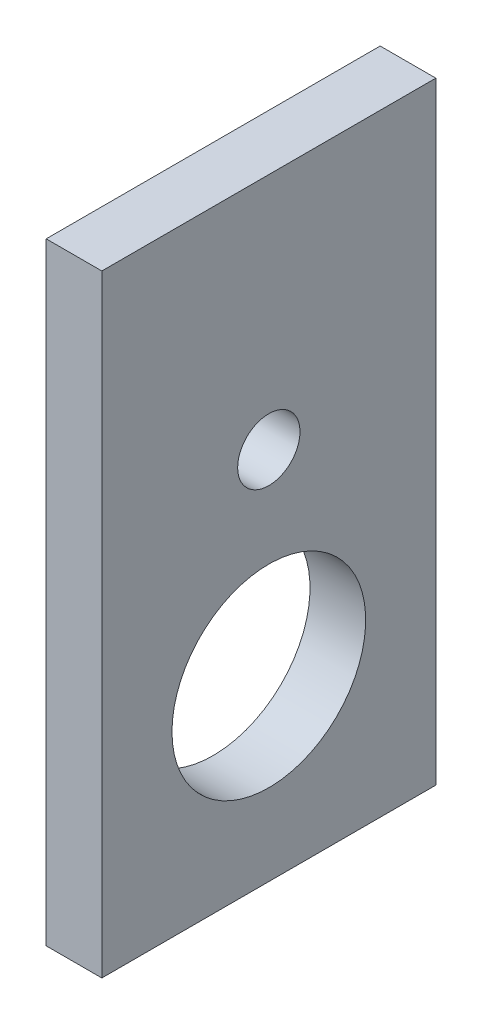
from build123d import *

# Parameters (mm, degrees)
BOSS_EXTRUDE1_DEPTH = 38.1
SKETCH2_R           = 11.049
CUT_EXTRUDE1_DEPTH  = 6.35
SKETCH2_4_R         = 3.556
CUT_EXTRUDE2_DEPTH  = 6.35
SKETCH4_W           = 94.447991824
SKETCH4_H           = 31.75
CUT_EXTRUDE5_DEPTH  = 76.2


with BuildPart() as part:
    # Sketch1 → Boss-Extrude1 (new body)
    with BuildSketch(Plane.XY):
        Polygon((0, 76.2), (0, 0), (6.35, 0), (6.35, 69.85), (94.447991824, 69.85), (94.447991824, 101.6), (88.097991824, 101.6), (88.097991824, 76.2), align=None)
    extrude(amount=BOSS_EXTRUDE1_DEPTH)

    # Sketch2 → Cut-Extrude1 (cut)
    with BuildSketch(Plane.ZY):
        with Locations((19.05, 20.32)):
            Circle(SKETCH2_R)
    extrude(amount=-CUT_EXTRUDE1_DEPTH, mode=Mode.SUBTRACT)

    # Sketch2<4> → Cut-Extrude2 (cut)
    with BuildSketch(Plane.ZY):
        with Locations((19.05, 42.672)):
            Circle(SKETCH2_4_R)
    extrude(amount=-CUT_EXTRUDE2_DEPTH, mode=Mode.SUBTRACT)

    # Sketch4 → Cut-Extrude5 (cut)
    with BuildSketch(Plane.XY.offset(38.1)):
        with Locations((47.223995912, 85.725)):
            Rectangle(SKETCH4_W, SKETCH4_H)
    extrude(amount=-CUT_EXTRUDE5_DEPTH, mode=Mode.SUBTRACT)


solid = part.part
